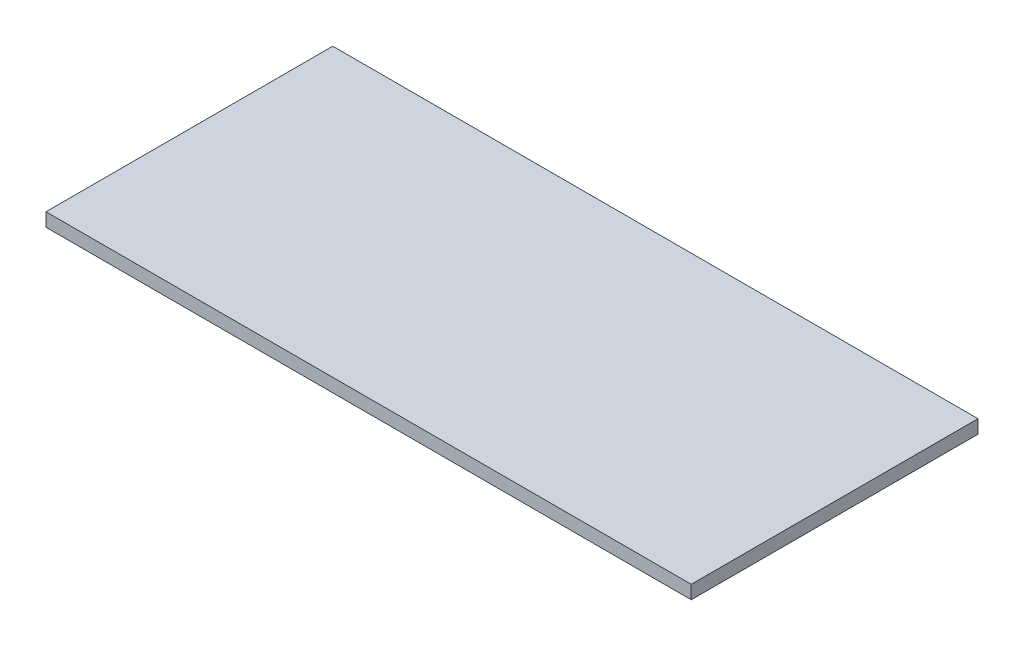
from build123d import *

# Parameters (mm, degrees)
SKETCH1_W           = 914.4
SKETCH1_H           = 406.4
BOSS_EXTRUDE1_DEPTH = 19.05


with BuildPart() as part:
    # Sketch1 → Boss-Extrude1 (new body)
    with BuildSketch(Plane(origin=(0, 0, 0), x_dir=(1, 0, 0), z_dir=(0, 1, 0))):
        with Locations((457.2, 203.2)):
            Rectangle(SKETCH1_W, SKETCH1_H)
    extrude(amount=BOSS_EXTRUDE1_DEPTH)


solid = part.part
